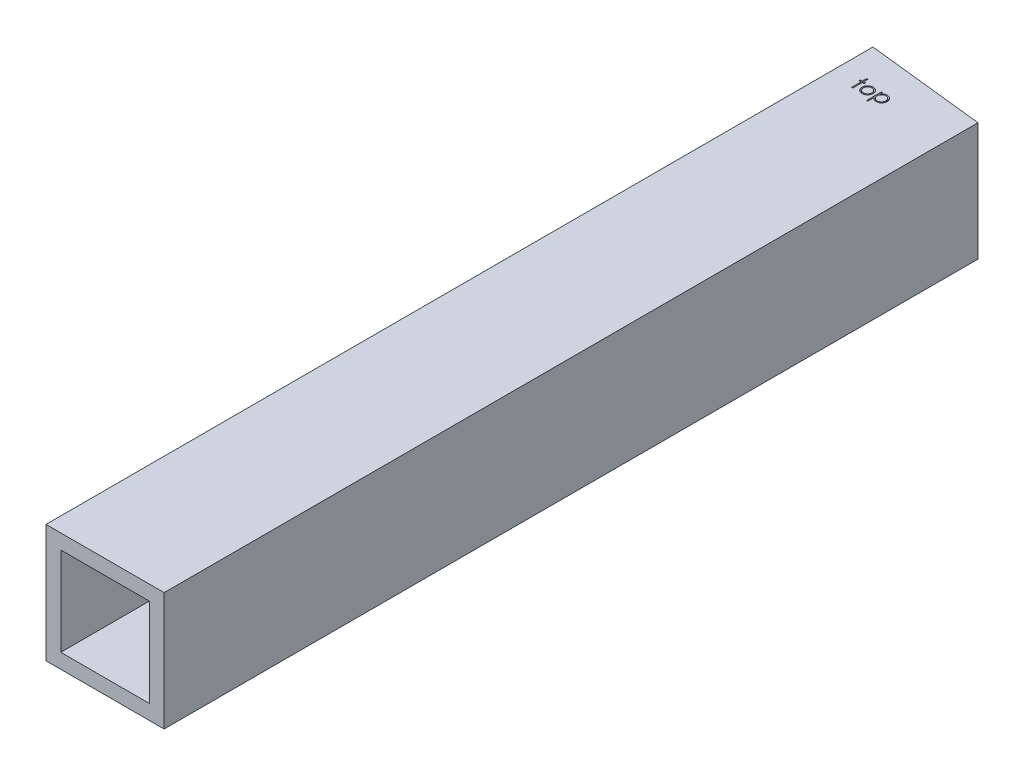
from build123d import *

# Parameters (mm, degrees)
SKETCH2_W           = 25.4
SKETCH2_H           = 25.4
SKETCH2_W_2         = 19.05
SKETCH2_H_2         = 19.05
BOSS_EXTRUDE1_DEPTH = 177.8
CUT_EXTRUDE1_DEPTH  = 182.392282085


with BuildPart() as part:
    # Sketch2 → Boss-Extrude1 (new body)
    with BuildSketch(Plane.XY):
        with Locations((12.7, 12.7)):
            Rectangle(SKETCH2_W, SKETCH2_H)
        with Locations((12.7, 12.7)):
            Rectangle(SKETCH2_W_2, SKETCH2_H_2, mode=Mode.SUBTRACT)
    extrude(amount=BOSS_EXTRUDE1_DEPTH)

    # Sketch3 → Cut-Extrude1 (cut, through all)
    # profile 1 of 4: a face of its own
    with BuildSketch(Plane(origin=(0, 25.4, 0), x_dir=(1, 0, 0), z_dir=(0, 1, 0))):
        Polygon((0, 0), (25.4, -2.804186107), (25.4, 0), align=None)
    # profile 2 of 4: a face of its own
    with BuildSketch(Plane(origin=(0, 25.4, 0), x_dir=(1, 0, 0), z_dir=(0, 1, 0))):
        Polygon((5.206442936, -6.540941157), (5.491378833, -6.540941157), (5.491378833, -7.477159106), (5.898430115, -7.477159106), (5.898430115, -7.762095003), (5.491378833, -7.762095003), (5.491378833, -9.797351414), (5.206442936, -9.797351414), (5.206442936, -7.762095003), (4.799391654, -7.762095003), (4.799391654, -7.477159106), (5.206442936, -7.477159106), align=None)
    # profile 3 of 4: a face of its own
    with BuildSketch(Plane(origin=(0, 25.4, 0), x_dir=(1, 0, 0), z_dir=(0, 1, 0))):
        with BuildLine():
            add(Edge.make_bspline(
                [(7.507554714, -7.436453978), (7.551089655, -7.437380979), (7.636451034, -7.439198602), (7.761462473, -7.458625035), (7.880792703, -7.488331573), (7.994898749, -7.529399347), (8.102319246, -7.584446545), (8.204618874, -7.650132116), (8.301517161, -7.727949183), (8.359595195, -7.788145431), (8.389075147, -7.818700572)],
                knots=[0, 0, 0, 0, 1.054011418, 2.066658804, 3.057071809, 4.030435133, 4.997543892, 5.974964718, 6.972108034, 8, 8, 8, 8], degree=3))
            add(Edge.make_bspline(
                [(8.389075147, -7.818700572), (8.414458777, -7.847923259), (8.464734793, -7.905803094), (8.529201552, -7.999652114), (8.584738253, -8.096843491), (8.629245368, -8.198667852), (8.664338211, -8.304236304), (8.689253521, -8.4139117), (8.704073455, -8.527451829), (8.706071861, -8.604562453), (8.707083961, -8.643615436)],
                knots=[0, 0, 0, 0, 1.025258237, 2.030674902, 3.01204498, 3.988269485, 4.97094183, 5.956517959, 6.965070386, 8, 8, 8, 8], degree=3))
            add(Edge.make_bspline(
                [(8.707083961, -8.643615436), (8.706193748, -8.682894774), (8.704434645, -8.760512578), (8.687794365, -8.874830145), (8.661912594, -8.985678306), (8.624872284, -9.092592978), (8.577375999, -9.195900972), (8.519418018, -9.295151063), (8.450591623, -9.390539069), (8.372573711, -9.481255023), (8.286348081, -9.564862946), (8.192807003, -9.637732162), (8.093788701, -9.700163116), (7.987976516, -9.750451865), (7.876336725, -9.790102807), (7.758628527, -9.817952108), (7.635034785, -9.834790207), (7.550645806, -9.836952448), (7.507554714, -9.838056542)],
                knots=[0, 0, 0, 0, 0.998656419, 1.973391657, 2.932242238, 3.890759089, 4.846373663, 5.82037756, 6.809684879, 7.83454468, 8.860553229, 9.859544525, 10.845671541, 11.83227036, 12.833544569, 13.85385346, 14.904124723, 16, 16, 16, 16], degree=3))
            add(Edge.make_bspline(
                [(7.507554714, -9.838056542), (7.464252505, -9.836948742), (7.379442939, -9.834779061), (7.255412941, -9.818017526), (7.137493787, -9.790115642), (7.025707844, -9.750321559), (6.919440733, -9.700161509), (6.819848696, -9.637920905), (6.72623163, -9.564841335), (6.639987758, -9.481260878), (6.561974738, -9.390537561), (6.49314708, -9.295151454), (6.435189427, -9.19590087), (6.387693057, -9.092593005), (6.350652769, -8.985678299), (6.324770992, -8.874830147), (6.308130713, -8.760512577), (6.30637161, -8.682894774), (6.305481397, -8.643615436)],
                knots=[0, 0, 0, 0, 1.099876186, 2.154163076, 3.173186993, 4.173200201, 5.163417411, 6.152872554, 7.150605724, 8.17532212, 9.198891216, 10.186952605, 11.159729845, 12.11414092, 13.071450619, 14.029093627, 15.002601286, 16, 16, 16, 16], degree=3))
            add(Edge.make_bspline(
                [(6.305481397, -8.643615436), (6.3065004, -8.604774712), (6.308517851, -8.527876754), (6.323322884, -8.414550064), (6.348141003, -8.305060289), (6.383275913, -8.199899322), (6.428193265, -8.098521176), (6.482949576, -8.001089651), (6.548073935, -7.907665003), (6.598149991, -7.849859974), (6.623490211, -7.820608625)],
                knots=[0, 0, 0, 0, 1.031353054, 2.041901799, 3.029428768, 4.008703097, 4.981709435, 5.96992636, 6.972712378, 8, 8, 8, 8], degree=3))
            add(Edge.make_bspline(
                [(6.623490211, -7.820608625), (6.652925719, -7.789788502), (6.710815824, -7.729175306), (6.808196456, -7.651585088), (6.910244422, -7.584532649), (7.018852033, -7.530579225), (7.13286434, -7.488089998), (7.252806082, -7.458548424), (7.378241728, -7.439268595), (7.464020813, -7.437401533), (7.507554714, -7.436453978)],
                knots=[0, 0, 0, 0, 1.027980169, 2.021703884, 2.998553061, 3.971491411, 4.943284454, 5.930300938, 6.949603206, 8, 8, 8, 8], degree=3))
        make_face()
        with BuildLine():
            add(Edge.make_bspline(
                [(7.506282679, -7.721389875), (7.475496418, -7.722264898), (7.414718637, -7.723992354), (7.325256585, -7.737131325), (7.239132302, -7.757947989), (7.156182394, -7.787524526), (7.076686587, -7.825714241), (7.000568772, -7.872621111), (6.927605059, -7.927623864), (6.859222758, -7.990636431), (6.796464518, -8.059469518), (6.741602354, -8.13281053), (6.694952436, -8.209469858), (6.656090292, -8.289527221), (6.627145914, -8.373793911), (6.606124672, -8.461315626), (6.592998097, -8.552270683), (6.591286882, -8.614102464), (6.590417295, -8.645523489)],
                knots=[0, 0, 0, 0, 1.021534396, 2.016698045, 2.994645724, 3.958388632, 4.93408049, 5.916473867, 6.921342795, 7.962252576, 8.998418191, 10.008913653, 10.997312074, 11.973003931, 12.956656626, 13.948281152, 14.957379055, 16, 16, 16, 16], degree=3))
            add(Edge.make_bspline(
                [(6.590417295, -8.645523489), (6.591874913, -8.686119971), (6.594768014, -8.766696396), (6.618294978, -8.885360771), (6.657652532, -8.999281451), (6.710799564, -9.107790602), (6.777389491, -9.208186168), (6.855845616, -9.2976953), (6.945325916, -9.374971001), (7.044763741, -9.439088625), (7.152128015, -9.490033546), (7.265753392, -9.526136903), (7.384263164, -9.549606224), (7.465253542, -9.551938918), (7.506282679, -9.553120644)],
                knots=[0, 0, 0, 0, 1.016792936, 2.018143844, 3.017858371, 4.030088057, 5.03801393, 6.028138512, 7.003788237, 7.991172063, 8.984598303, 9.972568034, 10.972917682, 12, 12, 12, 12], degree=3))
            add(Edge.make_bspline(
                [(7.506282679, -9.553120644), (7.547309457, -9.551932033), (7.628295176, -9.549585747), (7.746640286, -9.526255104), (7.859955104, -9.489875354), (7.967207862, -9.439145921), (8.066600424, -9.374727516), (8.15672427, -9.29813166), (8.23451051, -9.207949095), (8.301034566, -9.107657622), (8.355051968, -8.999449674), (8.394225301, -8.885339746), (8.417808826, -8.76670175), (8.420694292, -8.686121765), (8.422148064, -8.645523489)],
                knots=[0, 0, 0, 0, 1.02726834, 2.027799167, 3.010890988, 4.004497153, 4.992059811, 5.971914811, 6.958719428, 7.966827853, 8.981595046, 9.981490638, 10.983022906, 12, 12, 12, 12], degree=3))
            add(Edge.make_bspline(
                [(8.422148064, -8.645523489), (8.421278776, -8.614102276), (8.41956815, -8.552270125), (8.40643729, -8.461317757), (8.385431907, -8.373786094), (8.356429083, -8.289556063), (8.317735799, -8.209262577), (8.27018628, -8.13303561), (8.215548135, -8.059215457), (8.152032604, -7.99085894), (8.083721683, -7.9275993), (8.010728398, -7.872599783), (7.934723453, -7.825920392), (7.855458596, -7.787197874), (7.772498053, -7.758217072), (7.686494443, -7.737011128), (7.597414094, -7.724047878), (7.536854104, -7.722281543), (7.506282679, -7.721389875)],
                knots=[0, 0, 0, 0, 1.042956736, 2.052379634, 3.044323526, 4.02829302, 5.004299113, 5.996692471, 7.007513377, 8.048758398, 9.090003419, 10.095195979, 11.07790575, 12.047570684, 13.018257071, 13.989683339, 14.985167495, 16, 16, 16, 16], degree=3))
        make_face(mode=Mode.SUBTRACT)
    # profile 4 of 4: a face of its own
    with BuildSketch(Plane(origin=(0, 25.4, 0), x_dir=(1, 0, 0), z_dir=(0, 1, 0))):
        with BuildLine():
            Line((9.276955756, -7.477159106), (9.561891654, -7.477159106))
            Line((9.561891654, -7.477159106), (9.561891654, -7.906471005))
            add(Edge.make_bspline(
                [(9.561891654, -7.906471005), (9.592151657, -7.867520346), (9.650955918, -7.791827536), (9.752306367, -7.693865063), (9.85928283, -7.611246751), (9.974638211, -7.546492597), (10.096579701, -7.497669431), (10.224606875, -7.461583788), (10.359806326, -7.440319021), (10.452240965, -7.437759372), (10.499381638, -7.436453978)],
                knots=[0, 0, 0, 0, 1.0828784, 2.104357462, 3.088488658, 4.04616522, 5.001424249, 5.969181776, 6.964304535, 8, 8, 8, 8], degree=3))
            add(Edge.make_bspline(
                [(10.499381638, -7.436453978), (10.540558306, -7.437645219), (10.621946155, -7.439999769), (10.74174637, -7.45594104), (10.85711261, -7.483262089), (10.967392202, -7.52263292), (11.073766554, -7.571306096), (11.174660888, -7.632735121), (11.271646756, -7.703860737), (11.362285013, -7.785714188), (11.446033682, -7.874276973), (11.518465575, -7.969547206), (11.580942231, -8.068391838), (11.631443143, -8.172343235), (11.671002144, -8.280582823), (11.699136887, -8.393547908), (11.715880607, -8.510819654), (11.718127102, -8.590559979), (11.719263448, -8.630895083)],
                knots=[0, 0, 0, 0, 1.041296284, 2.058176809, 3.050446431, 4.034000596, 5.01514041, 6.003636468, 7.015969324, 8.052561599, 9.08815499, 10.094063707, 11.074456064, 12.040834395, 13.011057502, 13.983766392, 14.980127149, 16, 16, 16, 16], degree=3))
            add(Edge.make_bspline(
                [(11.719263448, -8.630895083), (11.718151758, -8.672081463), (11.715959344, -8.753306948), (11.698954946, -8.872584529), (11.671779781, -8.987326647), (11.632719858, -9.09734245), (11.582245079, -9.202556191), (11.520827371, -9.302891993), (11.448358933, -9.39831771), (11.365535767, -9.48753784), (11.275680604, -9.56972436), (11.179634595, -9.641604609), (11.078888284, -9.701967142), (10.973957104, -9.752388827), (10.863942775, -9.790391022), (10.749358587, -9.817802884), (10.630266926, -9.834707034), (10.549258024, -9.836931478), (10.508285884, -9.838056542)],
                knots=[0, 0, 0, 0, 1.038740735, 2.04854663, 3.033179607, 4.009277356, 4.987731542, 5.972001279, 6.972200261, 8.005528982, 9.039189865, 10.040446548, 11.026516639, 11.997840187, 12.972163198, 13.956796175, 14.96660207, 16, 16, 16, 16], degree=3))
            add(Edge.make_bspline(
                [(10.508285884, -9.838056542), (10.462178016, -9.836881966), (10.371101457, -9.834561835), (10.237934999, -9.811049227), (10.109776712, -9.775909293), (9.988046463, -9.724475206), (9.871779948, -9.658929131), (9.761634838, -9.579000587), (9.65702607, -9.484856734), (9.594062411, -9.41343573), (9.561891654, -9.376943761)],
                knots=[0, 0, 0, 0, 1.014726462, 2.004382257, 2.969841629, 3.936926163, 4.907207904, 5.903978561, 6.929055279, 8, 8, 8, 8], degree=3))
            Line((9.561891654, -9.376943761), (9.561891654, -10.652159106))
            Line((9.561891654, -10.652159106), (9.276955756, -10.652159106))
            Line((9.276955756, -10.652159106), (9.276955756, -7.477159106))
        make_face()
        with BuildLine():
            add(Edge.make_bspline(
                [(10.496837567, -7.721389875), (10.464561821, -7.721970681), (10.401019196, -7.723114137), (10.307880826, -7.736697648), (10.218168546, -7.756416885), (10.13278649, -7.78627268), (10.050916287, -7.822920175), (9.973188509, -7.868714571), (9.899657716, -7.922827462), (9.83050891, -7.984222295), (9.768040065, -8.051872191), (9.71273798, -8.124069703), (9.666285639, -8.200723401), (9.627730235, -8.281119266), (9.598390257, -8.365887489), (9.57756614, -8.454545293), (9.564475749, -8.547189718), (9.562762213, -8.610286953), (9.561891654, -8.642343401)],
                knots=[0, 0, 0, 0, 1.05670511, 2.080379991, 3.077984906, 4.06214886, 5.038337365, 6.01289324, 7.01187578, 8.025460281, 9.038092164, 10.024533457, 11.000252242, 11.969694649, 12.940728589, 13.933144304, 14.949937299, 16, 16, 16, 16], degree=3))
            add(Edge.make_bspline(
                [(9.561891654, -8.642343401), (9.563334787, -8.684424046), (9.566162009, -8.766863593), (9.589146621, -8.887317761), (9.626552896, -9.001301763), (9.679646801, -9.107855703), (9.746727815, -9.205811561), (9.827552571, -9.293523754), (9.921389742, -9.370440933), (10.026679266, -9.435230213), (10.139547913, -9.487833673), (10.257282276, -9.525492993), (10.378263275, -9.548690657), (10.460058822, -9.551635986), (10.50128969, -9.553120644)],
                knots=[0, 0, 0, 0, 1.03728447, 2.032128127, 3.01272805, 3.987917167, 4.958271349, 5.931593992, 6.91984656, 7.941419022, 8.973179163, 9.983609215, 10.983593296, 12, 12, 12, 12], degree=3))
            add(Edge.make_bspline(
                [(10.50128969, -9.553120644), (10.541689994, -9.551708788), (10.621877334, -9.548906508), (10.739949344, -9.524651152), (10.854694424, -9.487598879), (10.963715009, -9.433569853), (11.06606203, -9.367357443), (11.158483153, -9.287927985), (11.239225139, -9.195862108), (11.308044947, -9.093347251), (11.363499937, -8.983423868), (11.405165226, -8.869685037), (11.429212289, -8.752531689), (11.432620233, -8.673612335), (11.434327551, -8.634075172)],
                knots=[0, 0, 0, 0, 1.00104056, 1.986885549, 2.97790532, 3.984399681, 4.995088187, 5.994304198, 6.996462723, 8.023150851, 9.048424203, 10.043036403, 11.019596776, 12, 12, 12, 12], degree=3))
            add(Edge.make_bspline(
                [(11.434327551, -8.634075172), (11.4330079, -8.594292431), (11.430378878, -8.515036899), (11.404482637, -8.398230551), (11.365566229, -8.284032173), (11.308816231, -8.17560996), (11.24150508, -8.073307756), (11.160091733, -7.982998166), (11.068818469, -7.903921913), (10.966593298, -7.838593648), (10.856883055, -7.786627521), (10.741390239, -7.748633077), (10.620700685, -7.72579689), (10.538488456, -7.722871802), (10.496837567, -7.721389875)],
                knots=[0, 0, 0, 0, 0.983928682, 1.960191568, 2.949917689, 3.96440592, 4.982380491, 5.975291189, 6.965713506, 7.964880129, 8.970154049, 9.96478489, 10.968906225, 12, 12, 12, 12], degree=3))
        make_face(mode=Mode.SUBTRACT)
    extrude(amount=-CUT_EXTRUDE1_DEPTH, mode=Mode.SUBTRACT)


with BuildPart() as cut_extrude1_piece_1:
    # of the separate pieces the step leaves, piece 1, a body of its own (cut_extrude1_pieces)
    add(part.part.solids().sort_by_distance((0, 0, 0))[0])


with BuildPart() as cut_extrude1_piece_2:
    # of the separate pieces the step leaves, piece 2, a body of its own (cut_extrude1_pieces)
    add(part.part.solids().sort_by_distance((9.561891654, 0, 8.642343401))[0])


with BuildPart() as cut_extrude1_piece_3:
    # of the separate pieces the step leaves, piece 3, a body of its own (cut_extrude1_pieces)
    add(part.part.solids().sort_by_distance((10.496837567, 25.4, 7.721389875))[0])


with BuildPart() as cut_extrude1_piece_4:
    # of the separate pieces the step leaves, piece 4, a body of its own (cut_extrude1_pieces)
    add(part.part.solids().sort_by_distance((6.590417295, 0, 8.645523489))[0])


with BuildPart() as cut_extrude1_piece_5:
    # of the separate pieces the step leaves, piece 5, a body of its own (cut_extrude1_pieces)
    add(part.part.solids().sort_by_distance((7.506282679, 25.4, 7.721389875))[0])


solid = Compound([cut_extrude1_piece_1.part, cut_extrude1_piece_2.part, cut_extrude1_piece_3.part, cut_extrude1_piece_4.part, cut_extrude1_piece_5.part])
